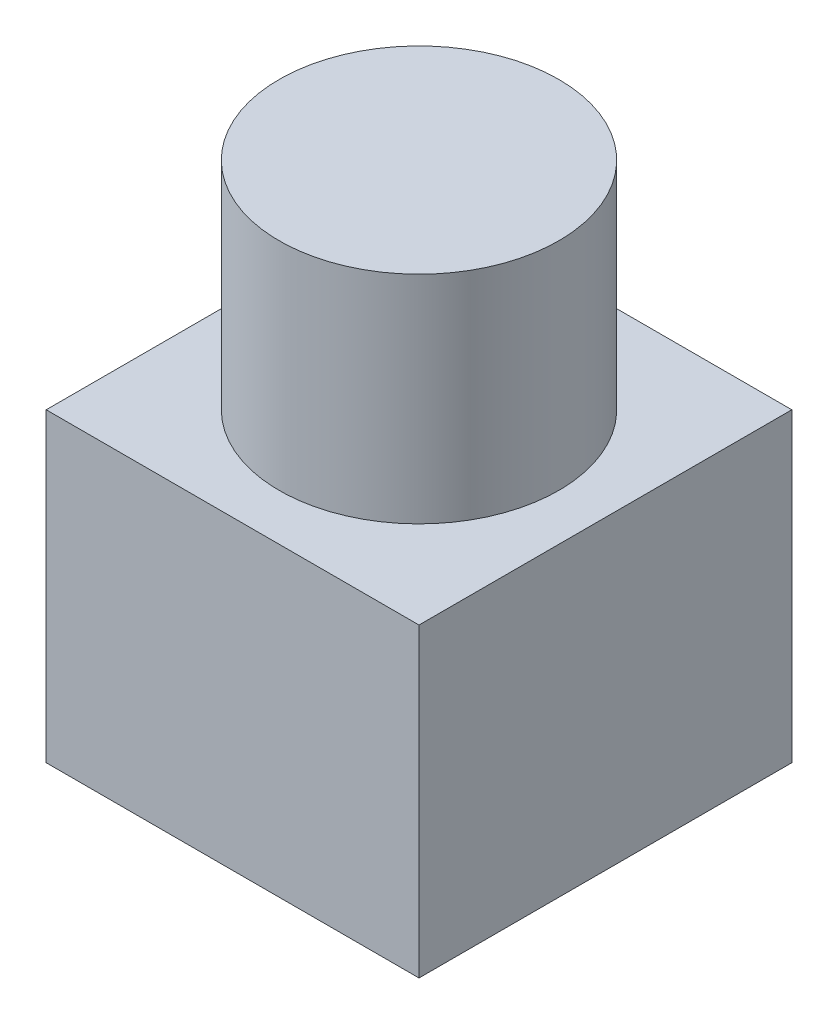
from build123d import *

# Parameters (mm, degrees)
SKETCH1_W           = 50
SKETCH1_H           = 50
BOSS_EXTRUDE1_DEPTH = 41
SKETCH2_R           = 18.75
BOSS_EXTRUDE2_DEPTH = 29


with BuildPart() as part:
    # Sketch1 → Boss-Extrude1 (new body)
    with BuildSketch(Plane(origin=(0, 0, 0), x_dir=(1, 0, 0), z_dir=(0, 1, 0))):
        Rectangle(SKETCH1_W, SKETCH1_H)
    extrude(amount=BOSS_EXTRUDE1_DEPTH)

    # Sketch2 → Boss-Extrude2 (add)
    with BuildSketch(Plane(origin=(0, 41, 0), x_dir=(1, 0, 0), z_dir=(0, 1, 0))):
        with Locations(Location((0, 0, 0), (0, 0, 90))):
            Circle(SKETCH2_R)
    extrude(amount=BOSS_EXTRUDE2_DEPTH)


solid = part.part
